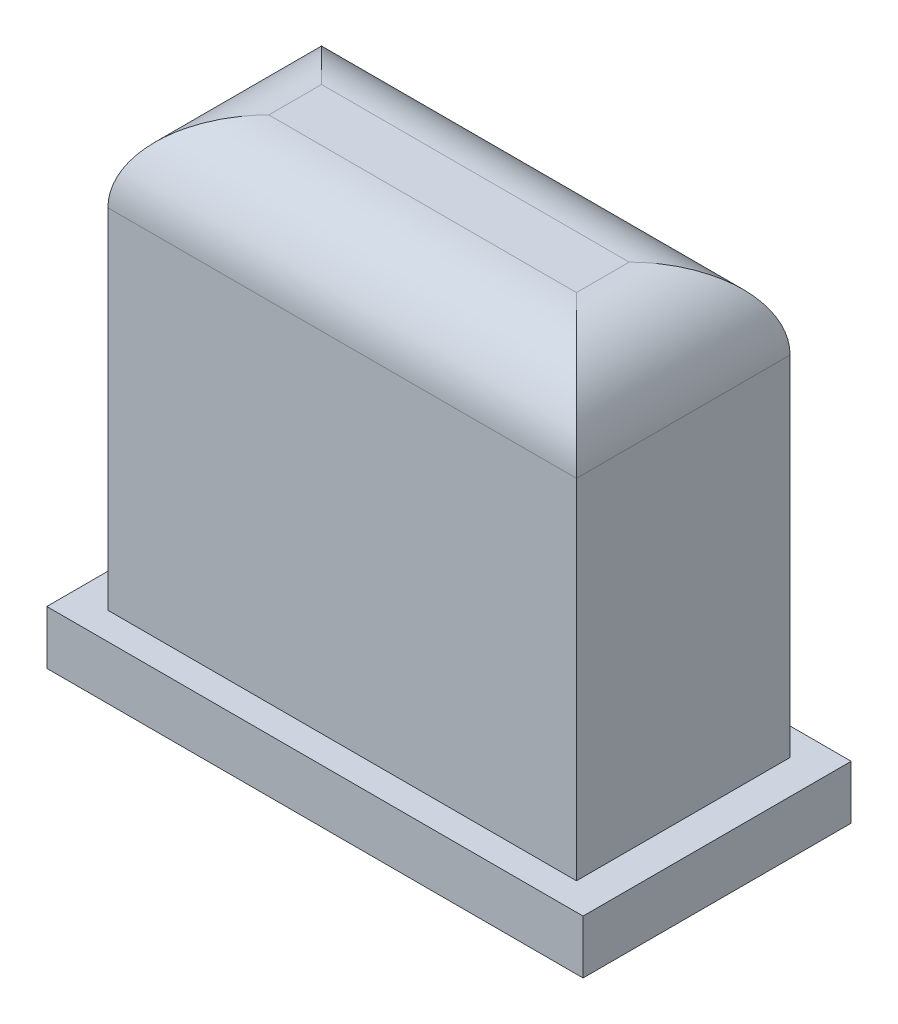
from build123d import *

# Parameters (mm, degrees)
CROQUIS1_W              = 100
CROQUIS1_H              = 50
SALIENTE_EXTRUIR1_DEPTH = 10
CROQUIS2_W              = 87.380374462
CROQUIS2_H              = 39.837581604
SALIENTE_EXTRUIR2_DEPTH = 80
REDONDEO1_R             = 15
CROQUIS3_R              = 6.082397519
SALIENTE_EXTRUIR3_DEPTH = 10


with BuildPart() as part:
    # Croquis1 → Saliente-Extruir1 (new body)
    with BuildSketch(Plane(origin=(0, 0, 0), x_dir=(1, 0, 0), z_dir=(0, 1, 0))):
        Rectangle(CROQUIS1_W, CROQUIS1_H)
    extrude(amount=SALIENTE_EXTRUIR1_DEPTH)

    # Croquis2 → Saliente-Extruir2 (add)
    with BuildSketch(Plane(origin=(0, 10, 0), x_dir=(1, 0, 0), z_dir=(0, 1, 0))):
        Rectangle(CROQUIS2_W, CROQUIS2_H)
    extrude(amount=SALIENTE_EXTRUIR2_DEPTH)

    # Redondeo1
    redondeo1_edges = [part.edges().sort_by_distance(p)[0] for p in [
        (-43.690187231, 90, 0),
        (0, 90, 19.918790802),
        (43.690187231, 90, 0),
        (0, 90, -19.918790802),
    ]]
    fillet(redondeo1_edges, radius=REDONDEO1_R)

    # Croquis3 → Saliente-Extruir3 (add)
    with BuildSketch(Plane.XZ):
        with Locations(Location((0, 0, 0), (0, 0, 270))):
            Circle(CROQUIS3_R)
    extrude(amount=SALIENTE_EXTRUIR3_DEPTH)


solid = part.part
